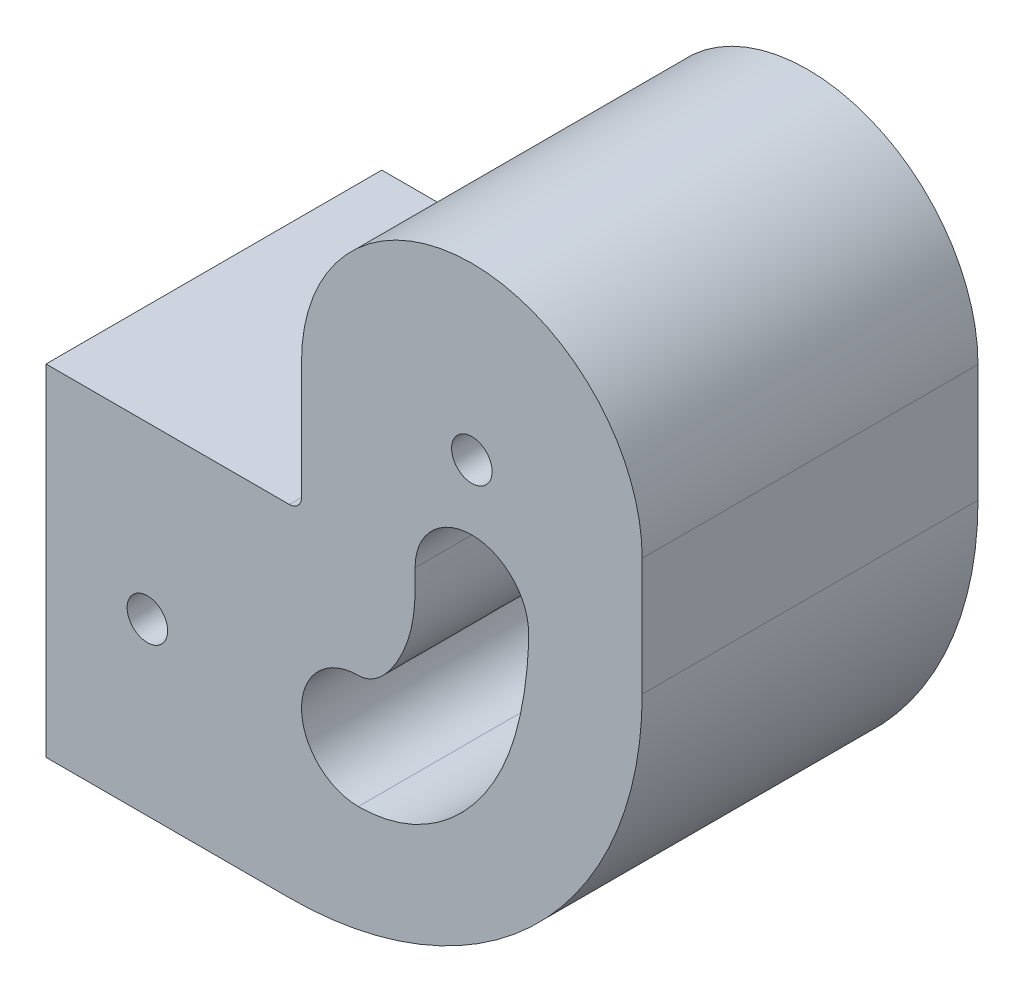
from build123d import *

# Parameters (mm, degrees)
SKETCH1_R           = 2.5
BOSS_EXTRUDE1_DEPTH = 41.4
SKETCH2_W           = 26
SKETCH2_H           = 26
CUT_EXTRUDE1_DEPTH  = 31
CUT_EXTRUDE4_DEPTH  = 41.4
SKETCH4_R           = 2.5
BOSS_EXTRUDE2_DEPTH = 0.4


with BuildPart() as part:
    # Sketch1 → Boss-Extrude1 (new body)
    with BuildSketch(Plane.XY):
        with BuildLine():
            Line((8.125515238, 31.748109782), (-21.874484762, 31.748109782))
            Line((-21.874484762, 31.748109782), (-21.874484762, -10.251890218))
            Line((-21.874484762, -10.251890218), (8.125515238, -10.251890218))
            ThreePointArc((8.125515238, -10.251890218), (38.88466022, 2.488964801), (51.625515238, 33.248109782))
            Line((51.625515238, 33.248109782), (51.625515238, 47.748109782))
            ThreePointArc((51.625515238, 47.748109782), (30.625515238, 68.748109782), (9.625515238, 47.748109782))
            Line((9.625515238, 47.748109782), (9.625515238, 33.248109782))
            ThreePointArc((9.625515238, 33.248109782), (9.18617541, 32.18744961), (8.125515238, 31.748109782))
        make_face()
        with Locations((-9.374484762, 10.748109782)):
            Circle(SKETCH1_R, mode=Mode.SUBTRACT)
        with Locations((30.625515238, 47.748109782)):
            Circle(SKETCH1_R, mode=Mode.SUBTRACT)
    extrude(amount=BOSS_EXTRUDE1_DEPTH)

    # Sketch2 → Cut-Extrude1 (cut)
    with BuildSketch(Plane.ZY.offset(21.874484762)):
        with Locations((20.7, 10.748109782)):
            Rectangle(SKETCH2_W, SKETCH2_H)
    extrude(amount=-CUT_EXTRUDE1_DEPTH, mode=Mode.SUBTRACT)

    # Sketch3 → Cut-Extrude4 (cut)
    with BuildSketch(Plane.XY.offset(41.4)):
        with BuildLine():
            ThreePointArc((23.625515238, 32.748109782), (30.625515238, 39.748109782), (37.625515238, 32.748109782))
            add(Edge.make_bspline(
                [(16.625515238, 3.748109782), (24.940509595, 3.748109782), (36.171087452, 14.120308293), (37.625515238, 29.35283955), (37.625515238, 32.748109782)],
                knots=[0, 0, 0, 0, 0.619735212, 1, 1, 1, 1], degree=3))
            ThreePointArc((16.625515238, 3.748109782), (9.625515238, 10.748109782), (16.625515238, 17.748109782))
            add(Edge.make_bspline(
                [(16.625515238, 17.748109782), (19.461751307, 17.748109782), (23.882566791, 24.826419712), (23.625515238, 30.398814735), (23.625515238, 32.748109782)],
                knots=[0, 0, 0, 0, 0.571663187, 1, 1, 1, 1], degree=3))
        make_face()
    extrude(amount=-CUT_EXTRUDE4_DEPTH, mode=Mode.SUBTRACT)

    # Sketch4 → Boss-Extrude2 (add)
    with BuildSketch(Plane(origin=(0, 0, 33.7), x_dir=(-1, 0, 0), z_dir=(0, 0, -1))):
        with Locations((9.374484762, 10.748109782)):
            Circle(SKETCH4_R)
    extrude(amount=-BOSS_EXTRUDE2_DEPTH)


solid = part.part
